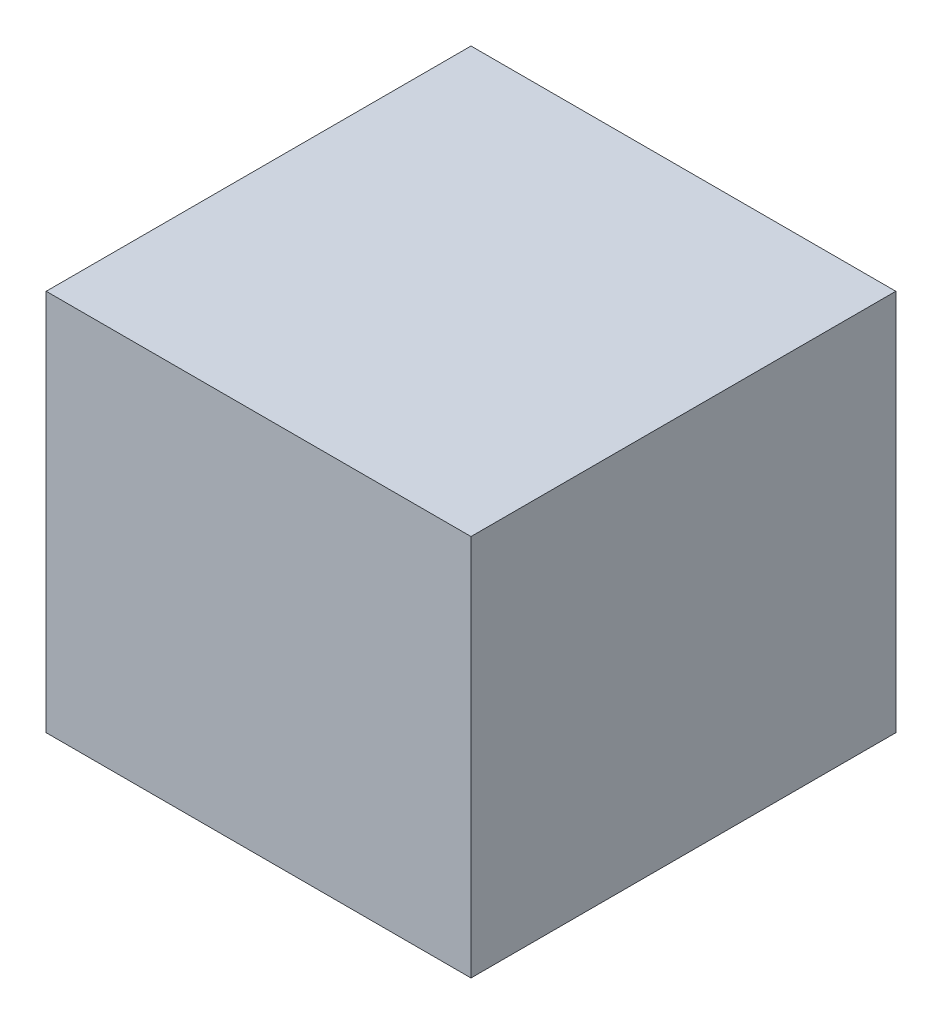
from build123d import *

# Parameters (mm, degrees)
SKETCH1_W           = 5
SKETCH1_H           = 5
BOSS_EXTRUDE1_DEPTH = 4.5


with BuildPart() as part:
    # Sketch1 → Boss-Extrude1 (new body)
    with BuildSketch(Plane(origin=(0, 0, 0), x_dir=(1, 0, 0), z_dir=(0, 1, 0))):
        Rectangle(SKETCH1_W, SKETCH1_H)
    extrude(amount=BOSS_EXTRUDE1_DEPTH)


solid = part.part
